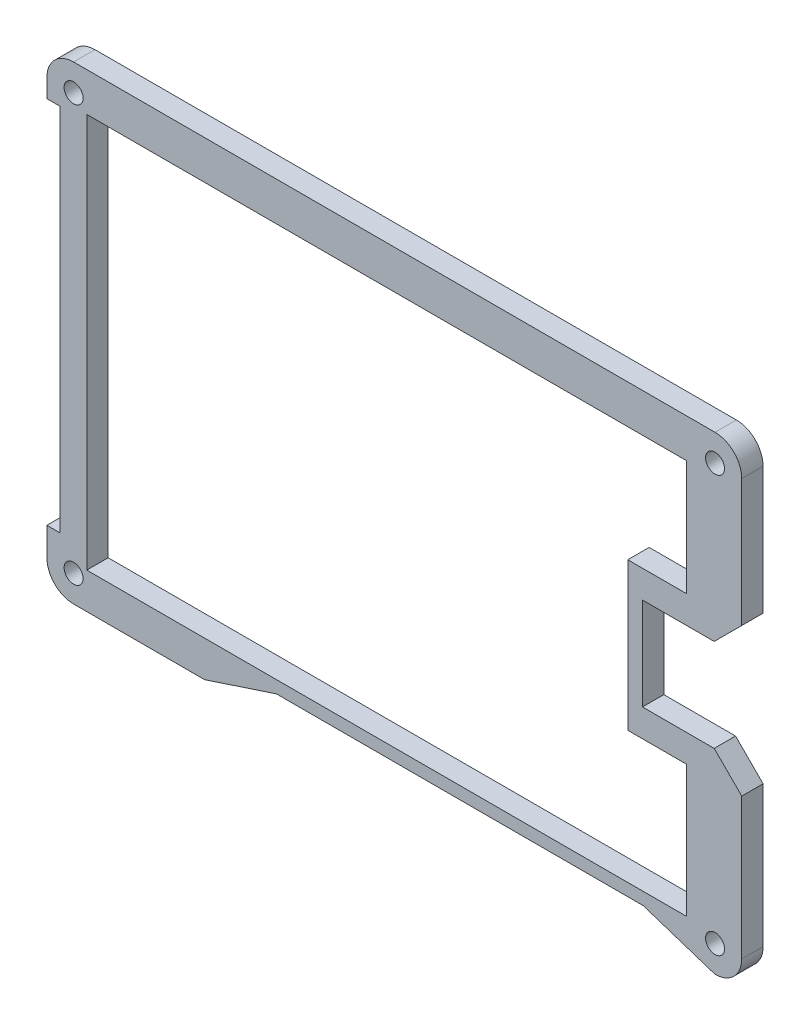
from build123d import *

# Parameters (mm, degrees)
BOSS_EXTRUDE1_DEPTH = 3.048
SKETCH2_R           = 1.355900406
CUT_EXTRUDE1_DEPTH  = 430.898988368


with BuildPart() as part:
    # Sketch1 → Boss-Extrude1 (new body)
    with BuildSketch(Plane.XY):
        with BuildLine():
            Line((-309.8086, 128.8851), (-305.87795, 128.8851))
            Line((-305.87795, 128.8851), (-301.9473, 132.81575))
            Line((-301.9473, 132.81575), (-301.9473, 150.9704))
            ThreePointArc((-301.9473, 150.9704), (-303.063223164, 153.664476836), (-305.7573, 154.7804))
            Line((-305.7573, 154.7804), (-397.247125, 154.7804))
            ThreePointArc((-397.247125, 154.7804), (-399.946077222, 153.659592612), (-401.0571, 150.956597849))
            Line((-401.0571, 150.956597849), (-401.0571, 148.341))
            Line((-401.0571, 148.341), (-399.1521, 148.341))
            Line((-399.1521, 148.341), (-399.1521, 95.6449))
            Line((-399.1521, 95.6449), (-401.0571, 95.6449))
            Line((-401.0571, 95.6449), (-401.0571, 91.659304166))
            ThreePointArc((-401.0571, 91.659304166), (-399.951018769, 88.947400452), (-397.2472, 87.8217))
            Line((-397.2472, 87.8217), (-378.5565, 87.8217))
            Line((-378.5565, 87.8217), (-368.3165, 91.1883))
            Line((-368.3165, 91.1883), (-315.9973, 91.1883))
            Line((-315.9973, 91.1883), (-305.7573, 87.8217))
            ThreePointArc((-305.7573, 87.8217), (-303.063223164, 88.937623164), (-301.9473, 91.6317))
            Line((-301.9473, 91.6317), (-301.9473, 111.74645))
            Line((-301.9473, 111.74645), (-305.87795, 115.6771))
            Line((-305.87795, 115.6771), (-309.8086, 115.6771))
            Line((-309.8086, 115.6771), (-316.1078, 115.6771))
            Line((-316.1078, 115.6771), (-316.1078, 128.8851))
            Line((-316.1078, 128.8851), (-309.8086, 128.8851))
        make_face()
        Polygon((-395.3675, 92.9525), (-395.3675, 149.2432), (-309.8086, 149.2432), (-309.8086, 132.81575), (-318.2033, 132.81575), (-318.2033, 111.74645), (-309.8086, 111.74645), (-309.8086, 92.9525), align=None, mode=Mode.SUBTRACT)
    extrude(amount=BOSS_EXTRUDE1_DEPTH)

    # Sketch2 → Cut-Extrude1 (cut, through all)
    with BuildSketch(Plane(origin=(0, 0, 0), x_dir=(-1, 0, 0), z_dir=(0, 0, -1))):
        with Locations((305.7573, 150.9704)):
            Circle(SKETCH2_R)
        with Locations((397.247125, 150.9704)):
            Circle(SKETCH2_R)
        with Locations((397.2472, 91.6317)):
            Circle(SKETCH2_R)
        with Locations((305.7573, 91.6317)):
            Circle(SKETCH2_R)
    extrude(amount=-CUT_EXTRUDE1_DEPTH, mode=Mode.SUBTRACT)


solid = part.part
